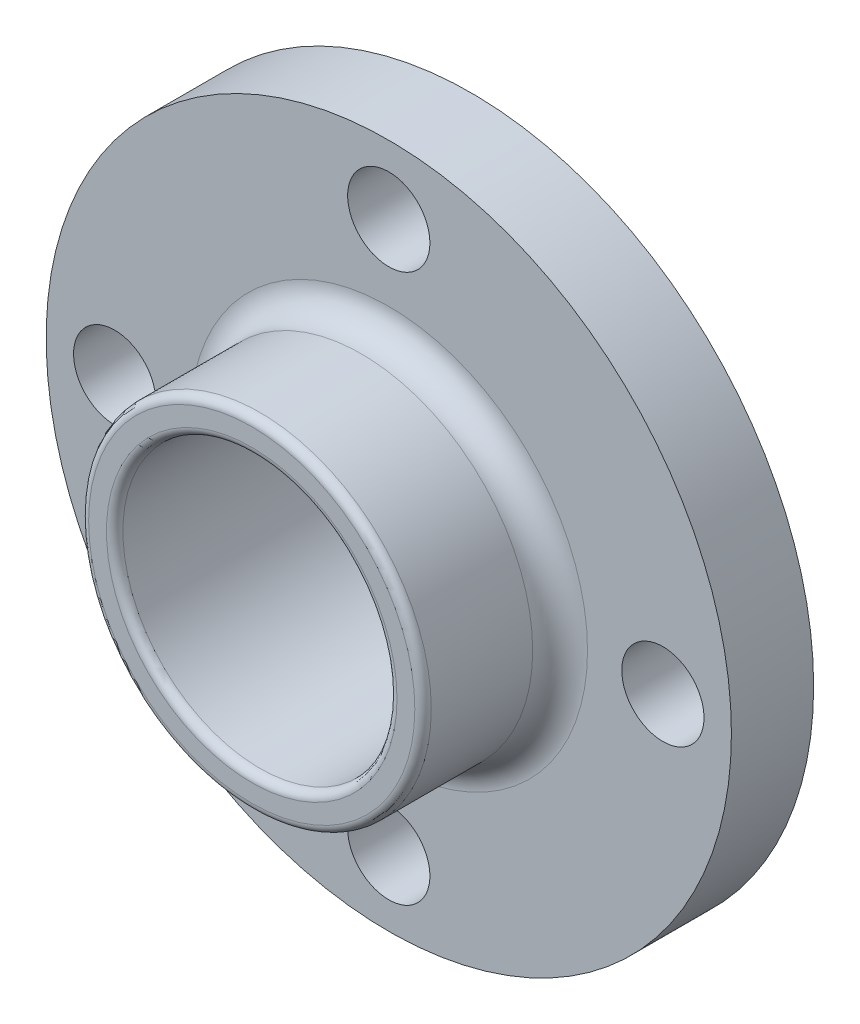
from build123d import *

# Parameters (mm, degrees)
SKETCH1_R           = 1.25
BOSS_EXTRUDE1_DEPTH = 0.3
SKETCH2_R           = 0.15
CUT_EXTRUDE1_DEPTH  = 0.3
CIRPATTERN2_COUNT   = 4
SKETCH3_R           = 0.625
BOSS_EXTRUDE2_DEPTH = 0.5
SKETCH4_R           = 0.5
CUT_EXTRUDE3_DEPTH  = 10.5
FILLET2_R           = 0.1
FILLET6_R           = 0.03


with BuildPart() as part:
    # Sketch1 → Boss-Extrude1 (new body)
    with BuildSketch(Plane.XY):
        Circle(SKETCH1_R)
    extrude(amount=BOSS_EXTRUDE1_DEPTH)

    # Sketch2 → Cut-Extrude1 (cut)
    with BuildSketch(Plane.XY.offset(0.3)):
        with Locations((0, 1)):
            Circle(SKETCH2_R)
    cut_extrude1 = extrude(amount=-CUT_EXTRUDE1_DEPTH, mode=Mode.SUBTRACT)

    # CirPattern2: Cut-Extrude1 ×4 about axis
    cirpattern2_axis = Axis((0, 0, 0), (0, 0, 1))
    for i in range(1, CIRPATTERN2_COUNT):
        add(cut_extrude1.rotate(cirpattern2_axis, i * 360 / CIRPATTERN2_COUNT), mode=Mode.SUBTRACT)

    # Sketch3 → Boss-Extrude2 (add)
    with BuildSketch(Plane.XY.offset(0.3)):
        Circle(SKETCH3_R)
    extrude(amount=BOSS_EXTRUDE2_DEPTH)

    # Sketch4 → Cut-Extrude3 (cut)
    with BuildSketch(Plane.XY.offset(0.8)):
        Circle(SKETCH4_R)
    extrude(amount=-CUT_EXTRUDE3_DEPTH, mode=Mode.SUBTRACT)

    # Fillet2
    fillet2_edges = [part.edges().sort_by_distance(p)[0] for p in [
        (-0.625, 0, 0.3),
    ]]
    fillet(fillet2_edges, radius=FILLET2_R)

    # Fillet6
    fillet6_edges = [part.edges().sort_by_distance(p)[0] for p in [
        (-0.625, 0, 0.8),
        (-0.5, 0, 0.8),
    ]]
    fillet(fillet6_edges, radius=FILLET6_R)


solid = part.part
